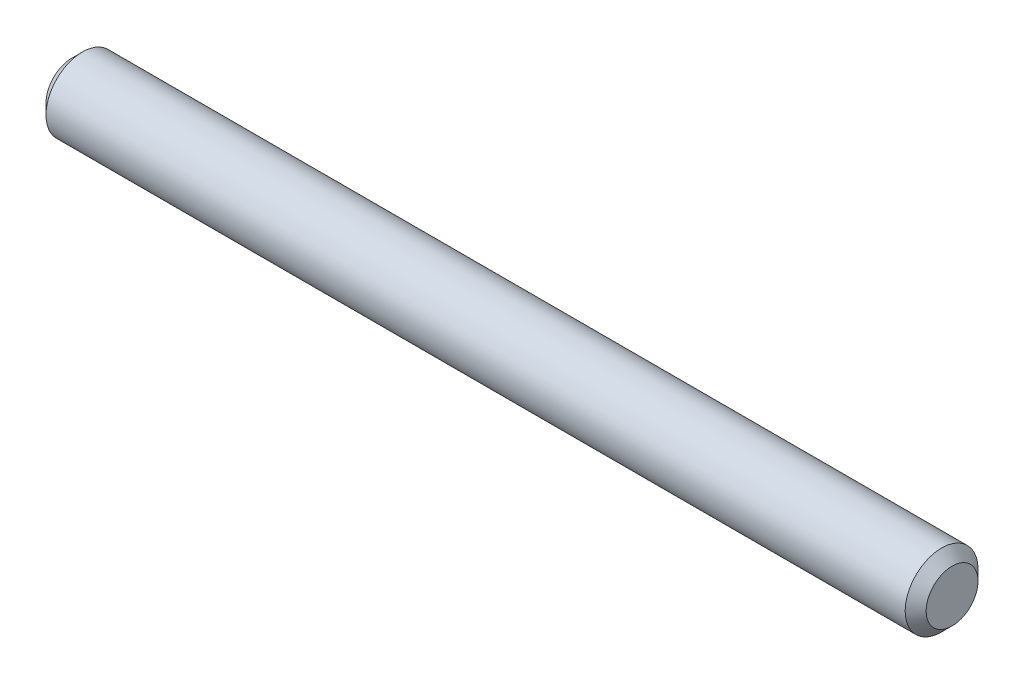
from build123d import *

# Parameters (mm, degrees)
SKETCH1_R           = 3.475
BOSS_EXTRUDE1_DEPTH = 42
CHAMFER1_SIZE       = 1


with BuildPart() as part:
    # Sketch1 → Boss-Extrude1 (new, symmetric)
    with BuildSketch(Plane(origin=(0, 0, 0), x_dir=(0, 0, -1), z_dir=(1, 0, 0))):
        with Locations(Location((0, 0, 0), (0, 0, 180))):
            Circle(SKETCH1_R)
    extrude(amount=BOSS_EXTRUDE1_DEPTH, both=True)

    # Chamfer1
    chamfer1_edges = [part.edges().sort_by_distance(p)[0] for p in [
        (-42, 0, -3.475),
        (42, 0, -3.475),
    ]]
    chamfer(chamfer1_edges, length=CHAMFER1_SIZE)


solid = part.part
